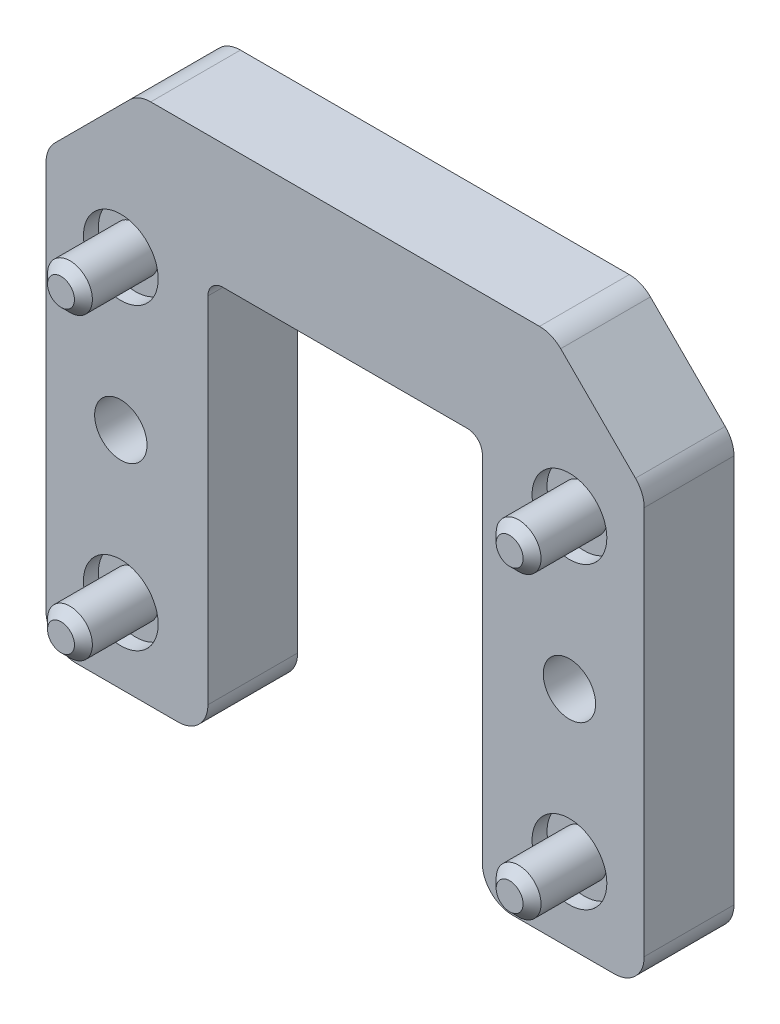
from build123d import *

# Parameters (mm, degrees)
SKICA2_R                 = 1.75
SKICA2_W                 = 18.35
SKICA2_H                 = 23.35
P_IDAT_VYSUNUT_M1_DEPTH  = 6
SKICA2_3_R               = 1.5
P_IDAT_VYSUNUT_M2_DEPTH  = 4
SKICA4_W                 = 18.35
SKICA4_H                 = 3.325
ODEBRAT_VYSUNUT_M2_DEPTH = 29.91366459
ODEBRAT_START            = -1
SKICA5_R                 = 2.5
SKICA5_R_2               = 1.5
ODEBRAT_VYSUNUT_M3_DEPTH = 1
ZKOSEN_1_SIZE            = 0.6
ZAOBLIT1_R               = 2
ZAOBLIT2_R               = 1


with BuildPart() as part:
    # Skica2 → Přidat vysunutím1 (new body)
    with BuildSketch(Plane.XY):
        with BuildLine():
            ThreePointArc((-19.414213562, 14.414213562), (-19.847759065, 13.765366865), (-20, 13))
            Line((-20, 13), (-20, -15))
            Line((-20, -15), (20, -15))
            Line((20, -15), (20, 13))
            ThreePointArc((20, 13), (19.847759065, 13.765366865), (19.414213562, 14.414213562))
            Line((19.414213562, 14.414213562), (13.828427125, 20))
            Line((13.828427125, 20), (-13.828427125, 20))
            Line((-13.828427125, 20), (-19.414213562, 14.414213562))
        make_face()
        with Locations((-15, 0)):
            Circle(SKICA2_R, mode=Mode.SUBTRACT)
        Rectangle(SKICA2_W, SKICA2_H, mode=Mode.SUBTRACT)
        with Locations((15, 0)):
            Circle(SKICA2_R, mode=Mode.SUBTRACT)
    extrude(amount=-P_IDAT_VYSUNUT_M1_DEPTH)

    # Skica2<3> → Přidat vysunutím2 (add)
    with BuildSketch(Plane.XY):
        with Locations((-15, 10)):
            Circle(SKICA2_3_R)
        with Locations((15, 10)):
            Circle(SKICA2_3_R)
        with Locations((15, -10)):
            Circle(SKICA2_3_R)
        with Locations((-15, -10)):
            Circle(SKICA2_3_R)
    extrude(amount=P_IDAT_VYSUNUT_M2_DEPTH)

    # Skica4 → Odebrat vysunutím2 (cut, through all)
    with BuildSketch(Plane.XY):
        with Locations((0, -13.3375)):
            Rectangle(SKICA4_W, SKICA4_H)
    extrude(amount=-ODEBRAT_VYSUNUT_M2_DEPTH, mode=Mode.SUBTRACT)

    # Skica5 → Odebrat vysunutím3 (cut)
    # profile 1 of 4: a face of its own
    with BuildSketch(Plane.XY.offset(ODEBRAT_START)):
        with Locations((-15, 10)):
            Circle(SKICA5_R)
        with Locations((-15, 10)):
            Circle(SKICA5_R_2, mode=Mode.SUBTRACT)
    # profile 2 of 4: a face of its own
    with BuildSketch(Plane.XY.offset(ODEBRAT_START)):
        with Locations((-15, -10)):
            Circle(SKICA5_R)
        with Locations((-15, -10)):
            Circle(SKICA5_R_2, mode=Mode.SUBTRACT)
    # profile 3 of 4: a face of its own
    with BuildSketch(Plane.XY.offset(ODEBRAT_START)):
        with Locations((15, -10)):
            Circle(SKICA5_R)
        with Locations((15, -10)):
            Circle(SKICA5_R_2, mode=Mode.SUBTRACT)
    # profile 4 of 4: a face of its own
    with BuildSketch(Plane.XY.offset(ODEBRAT_START)):
        with Locations((15, 10)):
            Circle(SKICA5_R)
        with Locations((15, 10)):
            Circle(SKICA5_R_2, mode=Mode.SUBTRACT)
    extrude(amount=ODEBRAT_VYSUNUT_M3_DEPTH, mode=Mode.SUBTRACT)

    # Zkosení1
    zkosen_1_edges = [part.edges().sort_by_distance(p)[0] for p in [
        (-16.5, -10, 4),
        (13.5, -10, 4),
        (13.5, 10, 4),
        (-16.5, 10, 4),
    ]]
    chamfer(zkosen_1_edges, length=ZKOSEN_1_SIZE)

    # Zaoblit1
    zaoblit1_edges = [part.edges().sort_by_distance(p)[0] for p in [
        (20, -15, -3),
        (-20, -15, -3),
        (9.175, -15, -3),
        (-9.175, -15, -3),
        (13.828427125, 20, -3),
        (-13.828427125, 20, -3),
    ]]
    fillet(zaoblit1_edges, radius=ZAOBLIT1_R)

    # Zaoblit2
    zaoblit2_edges = [part.edges().sort_by_distance(p)[0] for p in [
        (9.175, 11.675, -3),
        (-9.175, 11.675, -3),
    ]]
    fillet(zaoblit2_edges, radius=ZAOBLIT2_R)


solid = part.part
